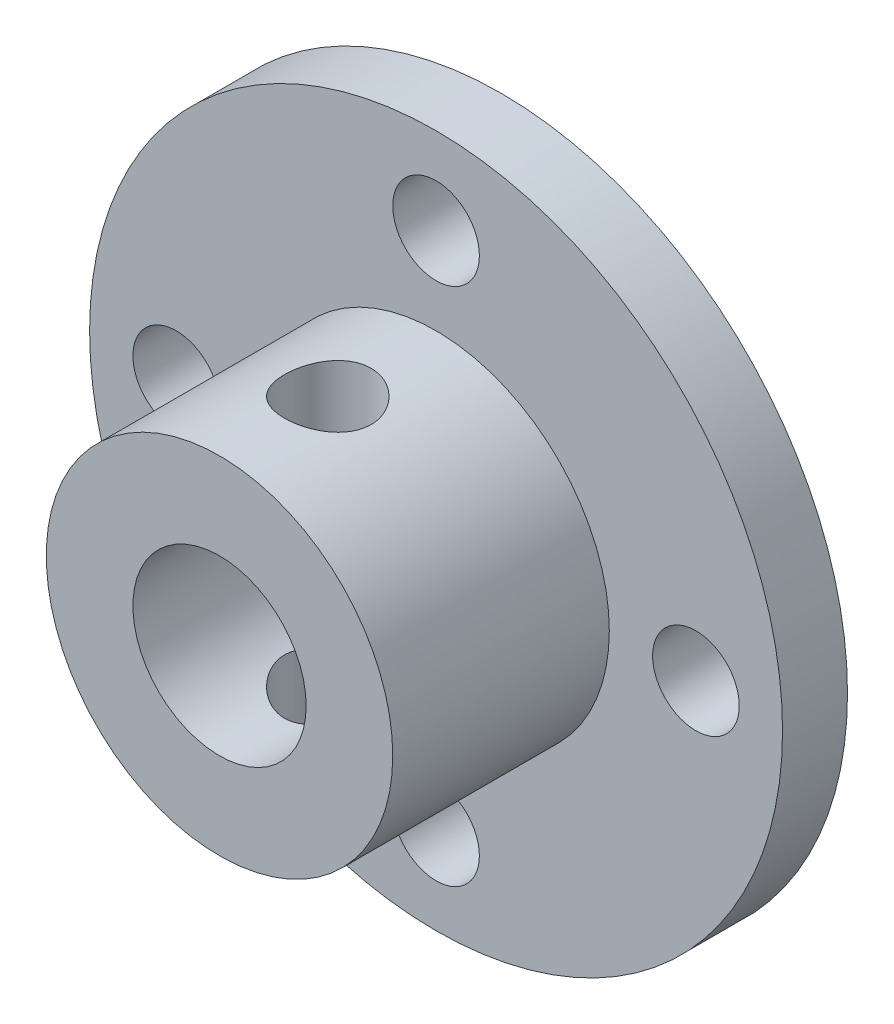
from build123d import *

# Parameters (mm, degrees)
SKETCH1_R               = 16
BOSS_EXTRUDE1_DEPTH     = 3
SKETCH2_R               = 8
SKETCH2_R_2             = 4
BOSS_EXTRUDE2_DEPTH     = 10
SKETCH3_R               = 2
CUT_EXTRUDE1_DEPTH      = 25.738633754
CUT_EXTRUDE2_DEPTH      = 27.095976701
CUT_EXTRUDE2_DEPTH_BACK = 27.095976701
SKETCH4_R               = 2
CUT_EXTRUDE3_START      = -10
SKETCH6_R               = 4
CUT_EXTRUDE3_DEPTH      = 10


with BuildPart() as part:
    # Sketch1 → Boss-Extrude1 (new body)
    with BuildSketch(Plane.XY):
        Circle(SKETCH1_R)
    extrude(amount=BOSS_EXTRUDE1_DEPTH)

    # Sketch2 → Boss-Extrude2 (add)
    with BuildSketch(Plane.XY.offset(3)):
        Circle(SKETCH2_R)
        Circle(SKETCH2_R_2, mode=Mode.SUBTRACT)
    extrude(amount=BOSS_EXTRUDE2_DEPTH)

    # Sketch3 → Cut-Extrude1 (cut, through all)
    with BuildSketch(Plane.XY.offset(3)):
        with Locations((0, 12)):
            Circle(SKETCH3_R)
        with Locations((12, 0)):
            Circle(SKETCH3_R)
        with Locations((0, -12)):
            Circle(SKETCH3_R)
        with Locations((-12, 0)):
            Circle(SKETCH3_R)
    extrude(amount=-CUT_EXTRUDE1_DEPTH, mode=Mode.SUBTRACT)

    # Sketch4 → Cut-Extrude2 (cut, two sides: drawn at the far end of the back side and taken through both)
    with BuildSketch(Plane(origin=(0, 0, 0), x_dir=(1, 0, 0), z_dir=(0, 1, 0)).offset(-CUT_EXTRUDE2_DEPTH_BACK)):
        with Locations(Location((0, -8, 0), (0, 0, 270))):
            Circle(SKETCH4_R)
    extrude(amount=CUT_EXTRUDE2_DEPTH + CUT_EXTRUDE2_DEPTH_BACK, mode=Mode.SUBTRACT)

    # Sketch6 → Cut-Extrude3 (cut)
    with BuildSketch(Plane.XY.offset(3).offset(CUT_EXTRUDE3_START)):
        Circle(SKETCH6_R)
    extrude(amount=CUT_EXTRUDE3_DEPTH, mode=Mode.SUBTRACT)


solid = part.part
